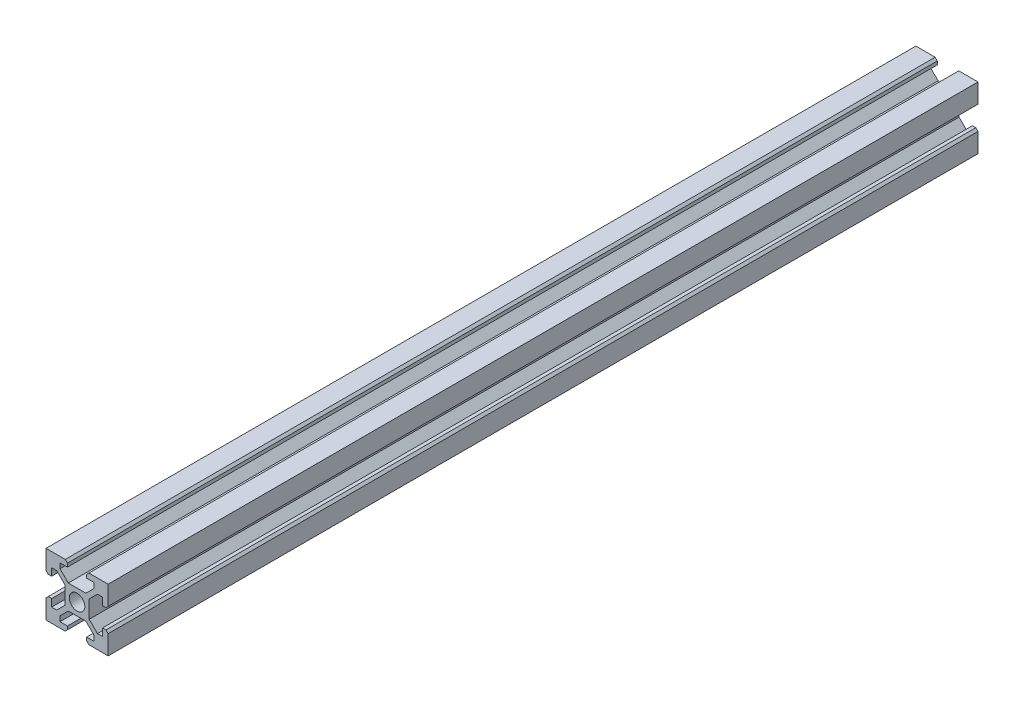
from build123d import *

# Parameters (mm, degrees)
SKETCH1_R           = 2.5
BOSS_EXTRUDE1_DEPTH = 140


with BuildPart() as part:
    # Sketch1 → Boss-Extrude1 (new, symmetric)
    with BuildSketch(Plane.XY):
        Polygon((3.9, -2.839339828), (6.560660172, -5.5), (8.200660172, -5.5), (8.200660172, -3.1), (9.3, -3.1), (10, -3.8), (10, -10), (3.8, -10), (3.1, -9.3), (3.1, -8.200660172), (5.5, -8.200660172), (5.5, -6.560660172), (2.839339828, -3.9), (-2.839339828, -3.9), (-5.5, -6.560660172), (-5.5, -8.200660172), (-3.1, -8.200660172), (-3.1, -9.3), (-3.8, -10), (-10, -10), (-10, -3.8), (-9.3, -3.1), (-8.200660172, -3.1), (-8.200660172, -5.5), (-6.560660172, -5.5), (-3.9, -2.839339828), (-3.9, 2.839339828), (-6.560660172, 5.5), (-8.200660172, 5.5), (-8.200660172, 3.1), (-9.3, 3.1), (-10, 3.8), (-10, 10), (-3.8, 10), (-3.1, 9.3), (-3.1, 8.200660172), (-5.5, 8.200660172), (-5.5, 6.560660172), (-2.839339828, 3.9), (2.839339828, 3.9), (5.5, 6.560660172), (5.5, 8.200660172), (3.1, 8.200660172), (3.1, 9.3), (3.8, 10), (10, 10), (10, 3.8), (9.3, 3.1), (8.200660172, 3.1), (8.200660172, 5.5), (6.560660172, 5.5), (3.9, 2.839339828), align=None)
        Circle(SKETCH1_R, mode=Mode.SUBTRACT)
    extrude(amount=BOSS_EXTRUDE1_DEPTH, both=True)


solid = part.part
